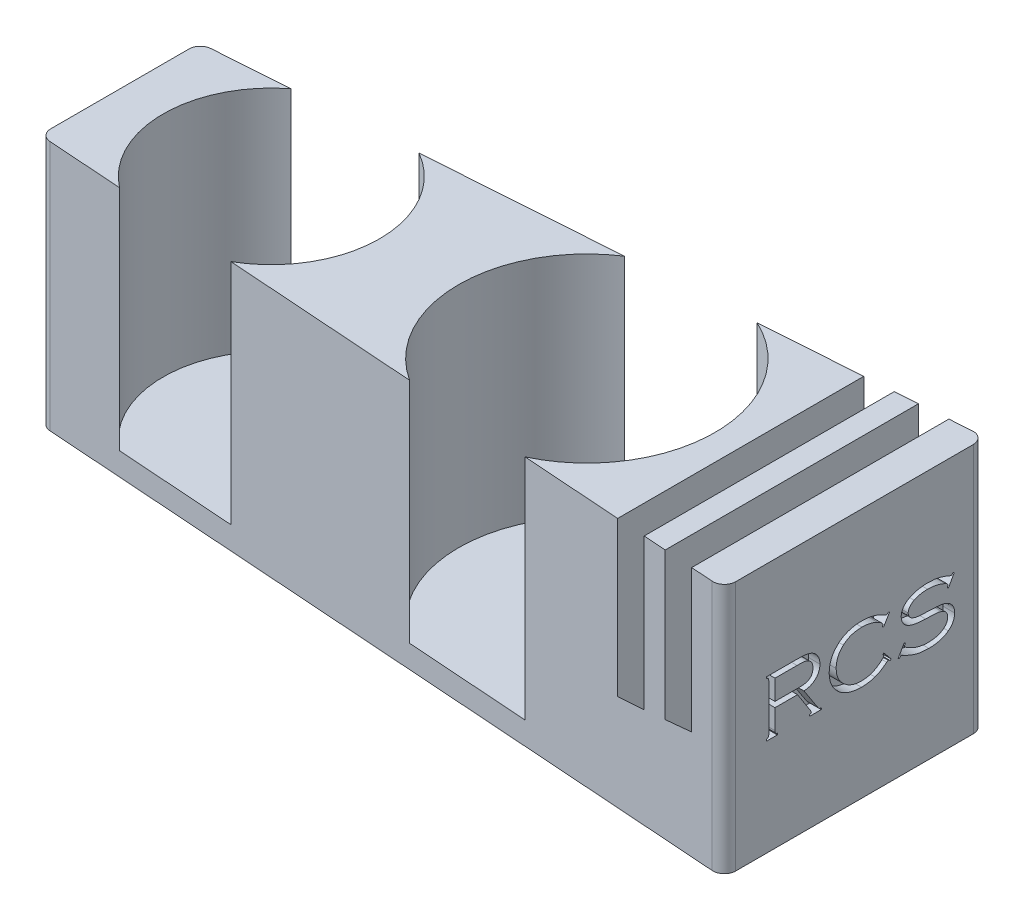
from build123d import *

# Parameters (mm, degrees)
BOSS_EXTRUDE1_DEPTH = 2
BOSS_EXTRUDE2_DEPTH = 20
BOSS_EXTRUDE3_DEPTH = 20
SKETCH5_R           = 12.25
CUT_EXTRUDE1_DEPTH  = 2.5
SKETCH6_W           = 22.580720552
SKETCH6_H           = 12.500036581
CUT_EXTRUDE3_DEPTH  = 2.5
BOSS_EXTRUDE4_DEPTH = 20
BOSS_EXTRUDE5_DEPTH = 20
SKETCH10_R          = 12.25
CUT_EXTRUDE4_DEPTH  = 2.5
CUT_EXTRUDE5_DEPTH  = 2.5
BOSS_EXTRUDE6_DEPTH = 20
SKETCH13_R          = 9.5
CUT_EXTRUDE6_DEPTH  = 20
SKETCH14_R          = 11.25
CUT_EXTRUDE7_DEPTH  = 20
CUT_EXTRUDE8_DEPTH  = 1
FILLET2_R           = 1


with BuildPart() as part:
    # Sketch1 → Boss-Extrude1 (new body)
    with BuildSketch(Plane(origin=(0, 0, 0), x_dir=(1, 0, 0), z_dir=(0, 1, 0))):
        Polygon((0, 7), (64.5, 11.5), (64.5, -11.5), (0, -7), align=None)
    extrude(amount=BOSS_EXTRUDE1_DEPTH)

    # Sketch2 → Boss-Extrude2 (add)
    with BuildSketch(Plane(origin=(0, 2, 0), x_dir=(1, 0, 0), z_dir=(0, 1, 0))):
        Polygon((61.502303199, 11.290858363), (61.497417875, -11.290517526), (64.5, -11.5), (64.5, 11.5), align=None)
    extrude(amount=BOSS_EXTRUDE2_DEPTH)

    # Sketch4 → Boss-Extrude3 (add)
    with BuildSketch(Plane(origin=(0, 2, 0), x_dir=(1, 0, 0), z_dir=(0, 1, 0))):
        Polygon((61.497417875, -11.290517526), (61.502303199, 11.290858363), (58.995164106, 11.115941682), (58.995163799, -11.11594166), align=None)
    extrude(amount=BOSS_EXTRUDE3_DEPTH)

    # Sketch5 → Cut-Extrude1 (cut)
    with BuildSketch(Plane(origin=(58.995163952, 0, 8.13e-07), x_dir=(-1.3778228676003005e-08, 0, 1.0), z_dir=(-1.0, 0, -1.3778228676003005e-08))):
        with Locations((0, 14.252883097)):
            Circle(SKETCH5_R)
    extrude(amount=-CUT_EXTRUDE1_DEPTH, mode=Mode.SUBTRACT)

    # Sketch6 → Cut-Extrude3 (cut)
    with BuildSketch(Plane(origin=(61.495163952, 0, 8.47e-07), x_dir=(-1.3778228676003005e-08, 0, 1.0), z_dir=(-1.0, 0, -1.3778228676003005e-08))):
        with Locations((-8.58e-07, 15.74998171)):
            Rectangle(SKETCH6_W, SKETCH6_H)
    extrude(amount=CUT_EXTRUDE3_DEPTH, mode=Mode.SUBTRACT)

    # Sketch8 → Boss-Extrude4 (add)
    with BuildSketch(Plane(origin=(0, 2, 0), x_dir=(1, 0, 0), z_dir=(0, 1, 0))):
        Polygon((58.995164106, 11.115941682), (57.006604835, 10.977204988), (57.006604835, -10.977204988), (58.995163799, -11.11594166), align=None)
    extrude(amount=BOSS_EXTRUDE4_DEPTH)

    # Sketch9 → Boss-Extrude5 (add)
    with BuildSketch(Plane(origin=(0, 2, 0), x_dir=(1, 0, 0), z_dir=(0, 1, 0))):
        Polygon((57.006604835, 10.977204988), (54.508882385, 10.802945283), (54.508862519, -10.802943897), (57.006604835, -10.977204988), align=None)
    extrude(amount=BOSS_EXTRUDE5_DEPTH)

    # Sketch10 → Cut-Extrude4 (cut)
    with BuildSketch(Plane(origin=(54.508872452, 0, 5.0119e-05), x_dir=(-9.194676961695594e-07, 0, 0.9999999999995773), z_dir=(-0.9999999999995773, 0, -9.194676961695594e-07))):
        with Locations((0, 14.224043544)):
            Circle(SKETCH10_R)
    extrude(amount=-CUT_EXTRUDE4_DEPTH, mode=Mode.SUBTRACT)

    # Sketch11 → Cut-Extrude5 (cut)
    with BuildSketch(Plane(origin=(57.008872452, 0, 5.2418e-05), x_dir=(-9.194676961695594e-07, 0, 0.9999999999995773), z_dir=(-0.9999999999995773, 0, -9.194676961695594e-07))):
        Polygon((-10.977416316, 8.787240161), (-10.977416316, 22), (11.07155829, 22), (10.977310072, 8.78702565), align=None)
    extrude(amount=CUT_EXTRUDE5_DEPTH, mode=Mode.SUBTRACT)

    # Sketch12 → Boss-Extrude6 (add)
    with BuildSketch(Plane(origin=(0, 2, 0), x_dir=(1, 0, 0), z_dir=(0, 1, 0))):
        Polygon((54.508903175, 10.802946733), (0, 7), (0, -7), (54.508862519, -10.802943897), align=None)
    extrude(amount=BOSS_EXTRUDE6_DEPTH)

    # Sketch13 → Cut-Extrude6 (cut)
    with BuildSketch(Plane(origin=(0, 22, 0), x_dir=(1, 0, 0), z_dir=(0, 1, 0))):
        with Locations((13.3, 0)):
            Circle(SKETCH13_R)
    extrude(amount=-CUT_EXTRUDE6_DEPTH, mode=Mode.SUBTRACT)

    # Sketch14 → Cut-Extrude7 (cut)
    with BuildSketch(Plane(origin=(0, 22, 0), x_dir=(1, 0, 0), z_dir=(0, 1, 0))):
        with Locations((41, 0)):
            Circle(SKETCH14_R)
    extrude(amount=-CUT_EXTRUDE7_DEPTH, mode=Mode.SUBTRACT)

    # Sketch15 → Cut-Extrude8 (cut)
    # profile 1 of 3: a face of its own
    with BuildSketch(Plane(origin=(64.5, 0, 0), x_dir=(0, 0, -1), z_dir=(1, 0, 0))):
        with BuildLine():
            Line((-6.982134582, 10.694974764), (-6.982134582, 8.956091526))
            add(Edge.make_bspline(
                [(-6.982134582, 8.956091526), (-6.98203032, 8.933742839), (-6.981837395, 8.892389471), (-6.972993331, 8.83579956), (-6.960908862, 8.7889922), (-6.942711467, 8.750557828), (-6.914793079, 8.719830406), (-6.877736044, 8.694801894), (-6.831529024, 8.672431884), (-6.79677405, 8.66138617), (-6.77818493, 8.655478236)],
                knots=[0, 0, 0, 0, 1.327292751, 2.455984248, 3.396056187, 4.196519374, 4.957218112, 5.833575765, 6.841261664, 8, 8, 8, 8], degree=3))
            Line((-6.77818493, 8.655478236), (-6.77818493, 8.519511801))
            Line((-6.77818493, 8.519511801), (-7.729949976, 8.519511801))
            Line((-7.729949976, 8.519511801), (-7.729949976, 8.655478236))
            add(Edge.make_bspline(
                [(-7.729949976, 8.655478236), (-7.711360728, 8.661386131), (-7.676605517, 8.672431772), (-7.630400033, 8.694802253), (-7.593338257, 8.719829311), (-7.565435121, 8.750561413), (-7.547028033, 8.789288679), (-7.535088965, 8.83723176), (-7.526318586, 8.895587306), (-7.526111812, 8.938347235), (-7.526000323, 8.961402715)],
                knots=[0, 0, 0, 0, 1.143860438, 2.138607913, 3.003713363, 3.754644928, 4.544830376, 5.492870617, 6.648195317, 8, 8, 8, 8], degree=3))
            Line((-7.526000323, 8.961402715), (-7.526000323, 12.972412553))
            add(Edge.make_bspline(
                [(-7.526000323, 12.972412553), (-7.526093765, 12.995474411), (-7.526267067, 13.038246169), (-7.535300143, 13.096865855), (-7.546748119, 13.145350982), (-7.565774472, 13.184383007), (-7.592933314, 13.216087063), (-7.630227262, 13.241216836), (-7.676717319, 13.262338831), (-7.711381598, 13.272756611), (-7.729949976, 13.278337032)],
                knots=[0, 0, 0, 0, 1.348407392, 2.500828586, 3.466505965, 4.254705557, 5.01937148, 5.882302788, 6.865627628, 8, 8, 8, 8], degree=3))
            Line((-7.729949976, 13.278337032), (-7.729949976, 13.414303468))
            Line((-7.729949976, 13.414303468), (-5.039301692, 13.414303468))
            add(Edge.make_bspline(
                [(-5.039301692, 13.414303468), (-4.952191108, 13.413349297), (-4.787106619, 13.411541034), (-4.553852214, 13.401946133), (-4.349291413, 13.383055004), (-4.170247374, 13.35705029), (-4.01103459, 13.320553967), (-3.865238811, 13.273566558), (-3.729821486, 13.216139057), (-3.646949903, 13.167342893), (-3.606342934, 13.143432835)],
                knots=[0, 0, 0, 0, 1.414819568, 2.681244393, 3.790189265, 4.749857557, 5.617503166, 6.439488343, 7.235351294, 8, 8, 8, 8], degree=3))
            add(Edge.make_bspline(
                [(-3.606342934, 13.143432835), (-3.566545443, 13.116535819), (-3.487247757, 13.062942714), (-3.382735812, 12.962642943), (-3.287969844, 12.850478576), (-3.236992562, 12.765698165), (-3.211190481, 12.722786676)],
                knots=[0, 0, 0, 0, 0.987068848, 1.966764049, 2.970880412, 4, 4, 4, 4], degree=3))
            add(Edge.make_bspline(
                [(-3.211190481, 12.722786676), (-3.184578822, 12.671020272), (-3.131359455, 12.567495151), (-3.077529992, 12.399195757), (-3.044925246, 12.221631884), (-3.04107169, 12.099751935), (-3.039107962, 12.037643311)],
                knots=[0, 0, 0, 0, 0.976717653, 1.953290301, 2.95702022, 4, 4, 4, 4], degree=3))
            add(Edge.make_bspline(
                [(-3.039107962, 12.037643311), (-3.039873216, 11.991185871), (-3.041374861, 11.900023281), (-3.060707553, 11.766862005), (-3.088393102, 11.639461278), (-3.130357304, 11.519397342), (-3.182928982, 11.405536143), (-3.246294485, 11.297568771), (-3.323932811, 11.197872863), (-3.410681298, 11.103929581), (-3.508620654, 11.019297949), (-3.615309053, 10.943493938), (-3.730641581, 10.87750265), (-3.854686911, 10.8208524), (-3.987786372, 10.77448636), (-4.129402614, 10.737073713), (-4.279826924, 10.710876718), (-4.383114627, 10.700356366), (-4.435950636, 10.694974764)],
                knots=[0, 0, 0, 0, 1.032453981, 2.025965659, 2.986981725, 3.928436394, 4.848129052, 5.773335344, 6.705853521, 7.653153547, 8.613330213, 9.579206836, 10.559963337, 11.56437173, 12.608029044, 13.691145095, 14.818923504, 16, 16, 16, 16], degree=3))
            Line((-4.435950636, 10.694974764), (-3.218626146, 8.830747469))
            add(Edge.make_bspline(
                [(-3.218626146, 8.830747469), (-3.199710454, 8.804108531), (-3.163161857, 8.752637199), (-3.0878916, 8.695306346), (-2.999452337, 8.660549876), (-2.936044593, 8.657210882), (-2.903141527, 8.655478236)],
                knots=[0, 0, 0, 0, 1.032470711, 1.994923467, 2.959540884, 4, 4, 4, 4], degree=3))
            Line((-2.903141527, 8.655478236), (-2.903141527, 8.519511801))
            Line((-2.903141527, 8.519511801), (-3.952632448, 8.519511801))
            Line((-3.952632448, 8.519511801), (-3.952632448, 8.655478236))
            add(Edge.make_bspline(
                [(-3.952632448, 8.655478236), (-3.928342073, 8.660510858), (-3.885649027, 8.669356253), (-3.832012923, 8.688730584), (-3.794996608, 8.716948615), (-3.789421526, 8.741985285), (-3.786923355, 8.753204111)],
                knots=[0, 0, 0, 0, 1.445170674, 2.540048811, 3.345801974, 4, 4, 4, 4], degree=3))
            add(Edge.make_bspline(
                [(-3.786923355, 8.753204111), (-3.78914121, 8.762501108), (-3.795340142, 8.788486328), (-3.819357611, 8.835031451), (-3.854919302, 8.901796285), (-3.88539492, 8.952002333), (-3.902707273, 8.980522995)],
                knots=[0, 0, 0, 0, 0.44689934, 1.249089129, 2.437283923, 4, 4, 4, 4], degree=3))
            Line((-3.902707273, 8.980522995), (-5.004247845, 10.694974764))
            Line((-5.004247845, 10.694974764), (-6.982134582, 10.694974764))
        make_face()
        with BuildLine():
            Line((-6.982134582, 11.170857287), (-4.996812181, 11.170857287))
            add(Edge.make_bspline(
                [(-4.996812181, 11.170857287), (-4.933426113, 11.171209552), (-4.814761162, 11.171869028), (-4.649308652, 11.178009062), (-4.508573901, 11.188119218), (-4.389650544, 11.202722139), (-4.285863773, 11.223357022), (-4.191254555, 11.250860702), (-4.102617177, 11.285668697), (-4.047635802, 11.314809642), (-4.020615666, 11.329130715)],
                knots=[0, 0, 0, 0, 1.520823022, 2.847130214, 3.971774452, 4.905411492, 5.72015636, 6.507876598, 7.266708457, 8, 8, 8, 8], degree=3))
            add(Edge.make_bspline(
                [(-4.020615666, 11.329130715), (-3.990883778, 11.347671378), (-3.932591301, 11.384022287), (-3.8580126, 11.453952588), (-3.793008473, 11.53067471), (-3.740992586, 11.617699978), (-3.700021149, 11.713417146), (-3.672110068, 11.818634622), (-3.653150229, 11.932506741), (-3.651702635, 12.011712497), (-3.65095692, 12.05251464)],
                knots=[0, 0, 0, 0, 0.982641165, 1.926570845, 2.859311877, 3.801456098, 4.764550391, 5.776195376, 6.854426767, 8, 8, 8, 8], degree=3))
            add(Edge.make_bspline(
                [(-3.65095692, 12.05251464), (-3.652325105, 12.093634302), (-3.654979301, 12.173403965), (-3.671234745, 12.288492596), (-3.701546224, 12.394002377), (-3.742878847, 12.490892274), (-3.797223437, 12.578107123), (-3.863369099, 12.656109346), (-3.941197262, 12.724907694), (-4.000889772, 12.761528918), (-4.031238044, 12.780147516)],
                knots=[0, 0, 0, 0, 1.141908399, 2.215233359, 3.217213402, 4.181493512, 5.130824203, 6.058529557, 7.012936919, 8, 8, 8, 8], degree=3))
            add(Edge.make_bspline(
                [(-4.031238044, 12.780147516), (-4.060074346, 12.794717627), (-4.118139205, 12.824056044), (-4.209680673, 12.860972645), (-4.307029258, 12.886438761), (-4.411923863, 12.907688955), (-4.533666506, 12.922741418), (-4.679822592, 12.930781011), (-4.854409932, 12.937603578), (-4.980161109, 12.938135068), (-5.047799594, 12.938420944)],
                knots=[0, 0, 0, 0, 0.745341083, 1.500820907, 2.271778287, 3.063238885, 3.96911947, 5.09888871, 6.439563143, 8, 8, 8, 8], degree=3))
            Line((-5.047799594, 12.938420944), (-6.982134582, 12.938420944))
            Line((-6.982134582, 12.938420944), (-6.982134582, 11.170857287))
        make_face(mode=Mode.SUBTRACT)
    # profile 2 of 3: a face of its own
    with BuildSketch(Plane(origin=(64.5, 0, 0), x_dir=(0, 0, -1), z_dir=(1, 0, 0))):
        with BuildLine():
            Line((3.079381621, 12.938420944), (2.549324972, 12.05251464))
            Line((2.549324972, 12.05251464), (2.452661334, 12.113062193))
            add(Edge.make_bspline(
                [(2.452661334, 12.113062193), (2.462179093, 12.146823562), (2.478671449, 12.205325204), (2.482787707, 12.265900796), (2.484528467, 12.29151814)],
                knots=[0, 0, 0, 0, 1.154202433, 2, 2, 2, 2], degree=3))
            add(Edge.make_bspline(
                [(2.484528467, 12.29151814), (2.482818147, 12.305192437), (2.479128294, 12.334693427), (2.455365997, 12.378271109), (2.417899138, 12.422596157), (2.367527603, 12.470659576), (2.302144288, 12.519899021), (2.222785081, 12.571962308), (2.129592625, 12.626987002), (2.061580049, 12.662561565), (2.025641749, 12.681359403)],
                knots=[0, 0, 0, 0, 0.528427833, 1.140032483, 1.879037193, 2.768916703, 3.822049475, 5.035818927, 6.433706882, 8, 8, 8, 8], degree=3))
            add(Edge.make_bspline(
                [(2.025641749, 12.681359403), (1.972863624, 12.707578409), (1.867425708, 12.759957637), (1.703541591, 12.825393708), (1.536129283, 12.880146858), (1.366417125, 12.927997904), (1.192243788, 12.96233598), (1.015025993, 12.988154802), (0.833714414, 13.003122129), (0.711680024, 13.005302777), (0.65004383, 13.006404162)],
                knots=[0, 0, 0, 0, 0.990833998, 1.979446473, 2.964339273, 3.952521199, 4.942889807, 5.947602928, 6.963391035, 8, 8, 8, 8], degree=3))
            add(Edge.make_bspline(
                [(0.65004383, 13.006404162), (0.568165663, 13.004993454), (0.408205408, 13.002237441), (0.174657661, 12.974270561), (-0.047386934, 12.932903594), (-0.257657796, 12.872174104), (-0.456089905, 12.793323635), (-0.642708881, 12.697150136), (-0.818465533, 12.58520431), (-0.924391536, 12.49631744), (-0.977304441, 12.451916044)],
                knots=[0, 0, 0, 0, 1.116881908, 2.181982346, 3.205473248, 4.196440491, 5.163727822, 6.11461875, 7.058201043, 8, 8, 8, 8], degree=3))
            add(Edge.make_bspline(
                [(-0.977304441, 12.451916044), (-1.028046738, 12.404165549), (-1.128134025, 12.30997948), (-1.256399707, 12.150910825), (-1.367212256, 11.983617274), (-1.45720985, 11.804671851), (-1.52584861, 11.614725546), (-1.575951043, 11.415156822), (-1.606543823, 11.20508892), (-1.6097969, 11.061551604), (-1.611460392, 10.98815239)],
                knots=[0, 0, 0, 0, 1.014640989, 2.001341491, 2.970512027, 3.935371108, 4.913448052, 5.908657242, 6.930571361, 8, 8, 8, 8], degree=3))
            add(Edge.make_bspline(
                [(-1.611460392, 10.98815239), (-1.609428616, 10.915097287), (-1.605435199, 10.771508945), (-1.573670839, 10.561157973), (-1.523165176, 10.360043096), (-1.450176565, 10.168393728), (-1.356416157, 9.986574464), (-1.242419385, 9.81399939), (-1.108880533, 9.650115199), (-1.004698757, 9.552631643), (-0.951810734, 9.50314398)],
                knots=[0, 0, 0, 0, 1.045243101, 2.054404389, 3.037758508, 4.008189886, 4.982846867, 5.959767557, 6.964273164, 8, 8, 8, 8], degree=3))
            add(Edge.make_bspline(
                [(-0.951810734, 9.50314398), (-0.897778438, 9.457082592), (-0.790722385, 9.365819573), (-0.616001987, 9.248827964), (-0.432605487, 9.149263959), (-0.239110327, 9.06870713), (-0.037082686, 9.004200384), (0.174819738, 8.960593878), (0.395354764, 8.931440664), (0.545847079, 8.928770056), (0.622425648, 8.927411106)],
                knots=[0, 0, 0, 0, 0.992433811, 1.966343341, 2.934746802, 3.906992647, 4.893800048, 5.896242675, 6.929495341, 8, 8, 8, 8], degree=3))
            add(Edge.make_bspline(
                [(0.622425648, 8.927411106), (0.697584829, 8.928810155), (0.846303085, 8.931578468), (1.065428974, 8.960685023), (1.278101894, 9.004754649), (1.483896357, 9.067876611), (1.683144736, 9.148586089), (1.875111058, 9.248354906), (2.061145178, 9.365000317), (2.177250448, 9.456042004), (2.235964828, 9.502081743)],
                knots=[0, 0, 0, 0, 1.031172007, 2.040390831, 3.028950235, 4.009892534, 4.991015447, 5.975791656, 6.976358799, 8, 8, 8, 8], degree=3))
            add(Edge.make_bspline(
                [(2.235964828, 9.502081743), (2.260982462, 9.520913292), (2.308283668, 9.556518377), (2.371508327, 9.611121613), (2.426212095, 9.659816709), (2.47111536, 9.703971392), (2.505667085, 9.74454985), (2.530444481, 9.780644398), (2.547183446, 9.812700453), (2.55013699, 9.833719776), (2.551449447, 9.843060068)],
                knots=[0, 0, 0, 0, 1.587426528, 3.001370576, 4.234572792, 5.301084547, 6.1931032, 6.9301606, 7.524598697, 8, 8, 8, 8], degree=3))
            add(Edge.make_bspline(
                [(2.551449447, 9.843060068), (2.550266884, 9.852664633), (2.547507241, 9.875077971), (2.536114179, 9.912637592), (2.516622035, 9.957842473), (2.499977832, 9.990111116), (2.490901894, 10.007706924)],
                knots=[0, 0, 0, 0, 0.656862919, 1.532863812, 2.654692323, 4, 4, 4, 4], degree=3))
            Line((2.490901894, 10.007706924), (2.576943154, 10.075690141))
            Line((2.576943154, 10.075690141), (3.215348057, 9.301318803))
            Line((3.215348057, 9.301318803), (3.126120084, 9.226962159))
            add(Edge.make_bspline(
                [(3.126120084, 9.226962159), (3.110528362, 9.240892316), (3.081940918, 9.266433278), (3.037826825, 9.295005923), (2.998642682, 9.315887794), (2.972284292, 9.318293279), (2.960410991, 9.319376845)],
                knots=[0, 0, 0, 0, 1.293860952, 2.372295961, 3.266790553, 4, 4, 4, 4], degree=3))
            add(Edge.make_bspline(
                [(2.960410991, 9.319376845), (2.952538322, 9.317886663), (2.933575852, 9.314297341), (2.902554707, 9.299305983), (2.86547995, 9.273696064), (2.838517988, 9.253289273), (2.823382318, 9.241833488)],
                knots=[0, 0, 0, 0, 0.602339461, 1.450822395, 2.56896506, 4, 4, 4, 4], degree=3))
            add(Edge.make_bspline(
                [(2.823382318, 9.241833488), (2.770823353, 9.201557917), (2.671150152, 9.125179033), (2.526728971, 9.020891424), (2.396319582, 8.932737807), (2.240918164, 8.834715467), (2.044671434, 8.733153815), (1.880819411, 8.671863048), (1.797260627, 8.640606907)],
                knots=[0, 0, 0, 0, 0.997120743, 1.890946972, 2.68215169, 3.367178705, 4.657353487, 6, 6, 6, 6], degree=3))
            add(Edge.make_bspline(
                [(1.797260627, 8.640606907), (1.70605278, 8.611102243), (1.521271781, 8.551327766), (1.230352432, 8.495640518), (0.927249277, 8.457464905), (0.720278877, 8.453530217), (0.614989984, 8.451528583)],
                knots=[0, 0, 0, 0, 0.955610556, 1.936003082, 2.950014347, 4, 4, 4, 4], degree=3))
            add(Edge.make_bspline(
                [(0.614989984, 8.451528583), (0.513643434, 8.453507712), (0.315386093, 8.457379346), (0.025339968, 8.489421013), (-0.249468248, 8.543894493), (-0.510578597, 8.617586033), (-0.756571693, 8.715210694), (-0.989360615, 8.831558359), (-1.20701055, 8.971302732), (-1.339161296, 9.080758115), (-1.405386264, 9.13560971)],
                knots=[0, 0, 0, 0, 1.114924198, 2.181050147, 3.205656836, 4.194615827, 5.161896158, 6.113211609, 7.054469962, 8, 8, 8, 8], degree=3))
            add(Edge.make_bspline(
                [(-1.405386264, 9.13560971), (-1.470459923, 9.195905408), (-1.598801049, 9.314823227), (-1.76564427, 9.513552706), (-1.907474502, 9.724191814), (-2.022547456, 9.947962028), (-2.113733323, 10.183469108), (-2.177006639, 10.432037488), (-2.216384935, 10.692649856), (-2.220971906, 10.870809305), (-2.223309351, 10.961596445)],
                knots=[0, 0, 0, 0, 1.029468752, 2.03036344, 3.005483654, 3.972873955, 4.946545143, 5.931937644, 6.94614926, 8, 8, 8, 8], degree=3))
            add(Edge.make_bspline(
                [(-2.223309351, 10.961596445), (-2.221536049, 11.033530972), (-2.218049851, 11.174949608), (-2.19466961, 11.383658823), (-2.153779514, 11.584502156), (-2.09910939, 11.778955644), (-2.026418503, 11.965494476), (-1.937203367, 12.144285764), (-1.835393377, 12.31787734), (-1.753537132, 12.424735026), (-1.712372981, 12.478471988)],
                knots=[0, 0, 0, 0, 1.057821681, 2.079609136, 3.08340757, 4.068984952, 5.046566163, 6.022259667, 7.005427102, 8, 8, 8, 8], degree=3))
            add(Edge.make_bspline(
                [(-1.712372981, 12.478471988), (-1.678542927, 12.519291284), (-1.611145813, 12.600612545), (-1.50113147, 12.714181085), (-1.385601238, 12.820350477), (-1.263772608, 12.918967898), (-1.135155844, 13.008635207), (-1.001272429, 13.092232357), (-0.860354242, 13.166307169), (-0.713799708, 13.23367393), (-0.560541003, 13.291565971), (-0.401462946, 13.342979287), (-0.236241848, 13.386422634), (-0.064506281, 13.421163227), (0.113002012, 13.449146762), (0.297069688, 13.467658591), (0.487360394, 13.479736372), (0.616387328, 13.481427753), (0.681910963, 13.482286685)],
                knots=[0, 0, 0, 0, 0.945323297, 1.883297627, 2.817501084, 3.742673649, 4.67655684, 5.612445219, 6.556058172, 7.514122137, 8.487631749, 9.476265062, 10.49494205, 11.532877102, 12.600271702, 13.698751591, 14.831359033, 16, 16, 16, 16], degree=3))
            add(Edge.make_bspline(
                [(0.681910963, 13.482286685), (0.769440876, 13.480372077), (0.944573743, 13.476541262), (1.205796604, 13.447897048), (1.465053971, 13.402608945), (1.7214737, 13.337100685), (1.97642382, 13.254131093), (2.22885293, 13.151765323), (2.479601221, 13.03189583), (2.641601839, 12.938776576), (2.723531967, 12.891682482)],
                knots=[0, 0, 0, 0, 0.976200939, 1.953216504, 2.927882183, 3.909755422, 4.902711129, 5.916307441, 6.946194151, 8, 8, 8, 8], degree=3))
            add(Edge.make_bspline(
                [(2.723531967, 12.891682482), (2.741536795, 12.881739169), (2.770215569, 12.865901082), (2.801994416, 12.858369555), (2.813822178, 12.855566398)],
                knots=[0, 0, 0, 0, 1.255620471, 2, 2, 2, 2], degree=3))
            add(Edge.make_bspline(
                [(2.813822178, 12.855566398), (2.823260125, 12.857895583), (2.847904436, 12.863977536), (2.884655343, 12.894226173), (2.931803861, 12.937857783), (2.964307302, 12.974836311), (2.982717984, 12.995781784)],
                knots=[0, 0, 0, 0, 0.518788388, 1.354657101, 2.501618075, 4, 4, 4, 4], degree=3))
            Line((2.982717984, 12.995781784), (3.079381621, 12.938420944))
        make_face()
    # profile 3 of 3: a face of its own
    with BuildSketch(Plane(origin=(64.5, 0, 0), x_dir=(0, 0, -1), z_dir=(1, 0, 0))):
        with BuildLine():
            Line((8.75598029, 13.104130037), (8.242919445, 12.182107649))
            Line((8.242919445, 12.182107649), (8.143069094, 12.235219537))
            add(Edge.make_bspline(
                [(8.143069094, 12.235219537), (8.152000707, 12.259623002), (8.167859704, 12.302953862), (8.1877451, 12.360343563), (8.199086162, 12.403044962), (8.202346668, 12.426749479), (8.203616647, 12.435982477)],
                knots=[0, 0, 0, 0, 1.483757732, 2.634564283, 3.46815771, 4, 4, 4, 4], degree=3))
            add(Edge.make_bspline(
                [(8.203616647, 12.435982477), (8.20276099, 12.445340289), (8.200973896, 12.464884678), (8.186367066, 12.492994361), (8.166233472, 12.522078608), (8.136287334, 12.550967599), (8.09829155, 12.58009639), (8.052047274, 12.609533819), (7.998730438, 12.64110442), (7.959130031, 12.659751822), (7.938057204, 12.669674787)],
                knots=[0, 0, 0, 0, 0.607169636, 1.268112509, 2.03013931, 2.91146364, 3.96412496, 5.148481403, 6.482602449, 8, 8, 8, 8], degree=3))
            add(Edge.make_bspline(
                [(7.938057204, 12.669674787), (7.877753777, 12.696448931), (7.757637888, 12.749779235), (7.573592317, 12.819373283), (7.38621591, 12.875875899), (7.19660337, 12.924975255), (7.003640857, 12.959898395), (6.808451924, 12.987066801), (6.610538559, 13.00335996), (6.477509681, 13.005385004), (6.410559283, 13.006404162)],
                knots=[0, 0, 0, 0, 1.004211035, 2.000246224, 2.992453697, 3.98197883, 4.979849601, 5.975301357, 6.9810154, 8, 8, 8, 8], degree=3))
            add(Edge.make_bspline(
                [(6.410559283, 13.006404162), (6.354956921, 13.005414831), (6.245777373, 13.003472204), (6.084720207, 12.993308006), (5.929504218, 12.973779078), (5.77928207, 12.947863115), (5.634910366, 12.91207915), (5.495137457, 12.871242319), (5.361253544, 12.821600842), (5.275841804, 12.78178242), (5.233599829, 12.762089474)],
                knots=[0, 0, 0, 0, 1.100774022, 2.161455134, 3.192520597, 4.19620711, 5.177095061, 6.135103414, 7.077680479, 8, 8, 8, 8], degree=3))
            add(Edge.make_bspline(
                [(5.233599829, 12.762089474), (5.194768097, 12.741444526), (5.119177917, 12.701256895), (5.017594338, 12.62598532), (4.926051437, 12.545043843), (4.850294823, 12.453388752), (4.787965171, 12.357587851), (4.743897675, 12.257151243), (4.715637833, 12.154265777), (4.712527243, 12.08420366), (4.710978844, 12.049327927)],
                knots=[0, 0, 0, 0, 1.13355636, 2.206590414, 3.254740046, 4.27976559, 5.265963583, 6.194811322, 7.101407709, 8, 8, 8, 8], degree=3))
            add(Edge.make_bspline(
                [(4.710978844, 12.049327927), (4.712122584, 12.020176813), (4.714410149, 11.96187243), (4.735674417, 11.875792985), (4.770071393, 11.792641753), (4.816625906, 11.713029411), (4.874859121, 11.64068635), (4.941370465, 11.575756007), (5.01706097, 11.520785157), (5.073439496, 11.49365539), (5.101882345, 11.47996848)],
                knots=[0, 0, 0, 0, 0.957919062, 1.915908973, 2.898175121, 3.911258258, 4.939304541, 5.944518821, 6.963014016, 8, 8, 8, 8], degree=3))
            add(Edge.make_bspline(
                [(5.101882345, 11.47996848), (5.135298741, 11.465908726), (5.204252309, 11.436896917), (5.314788859, 11.404115442), (5.433426938, 11.37570413), (5.539634143, 11.359879488), (5.633233943, 11.348538376), (5.714723827, 11.341313202), (5.806481577, 11.335223733), (5.908454511, 11.328786735), (6.021059446, 11.322526799), (6.143899968, 11.315933251), (6.277046664, 11.310681279), (6.369129011, 11.308141977), (6.41693271, 11.306823722)],
                knots=[0, 0, 0, 0, 0.977326068, 2.016678256, 3.105629518, 4.266128525, 4.9106475, 5.649171883, 6.472626623, 7.391392157, 8.405507546, 9.51500178, 10.709936153, 12, 12, 12, 12], degree=3))
            add(Edge.make_bspline(
                [(6.41693271, 11.306823722), (6.483154633, 11.304939104), (6.610674613, 11.301309996), (6.794750386, 11.2922125), (6.964345803, 11.283652818), (7.119193769, 11.276106831), (7.258963086, 11.264681426), (7.384386557, 11.2545656), (7.495281184, 11.243151137), (7.621285795, 11.226415359), (7.762066459, 11.201627674), (7.91659088, 11.16129339), (8.056075286, 11.112649728), (8.13994124, 11.069457993), (8.180247416, 11.048699943)],
                knots=[0, 0, 0, 0, 1.327296927, 2.555903972, 3.692392932, 4.729698951, 5.661742112, 6.501857616, 7.250824416, 7.89495221, 9.048516985, 10.111912734, 11.092580788, 12, 12, 12, 12], degree=3))
            add(Edge.make_bspline(
                [(8.180247416, 11.048699943), (8.228930084, 11.019902102), (8.323561679, 10.96392354), (8.447980554, 10.8599853), (8.553618072, 10.746104781), (8.642012912, 10.621548222), (8.707110754, 10.484056319), (8.755759262, 10.336869252), (8.784868308, 10.178097157), (8.788238736, 10.068376927), (8.789971899, 10.011955875)],
                knots=[0, 0, 0, 0, 1.069345705, 2.078643101, 3.055776152, 4.004137249, 4.9574836, 5.924075733, 6.932504666, 8, 8, 8, 8], degree=3))
            add(Edge.make_bspline(
                [(8.789971899, 10.011955875), (8.788531086, 9.957658148), (8.785706539, 9.851213786), (8.75772971, 9.695521714), (8.714724389, 9.547337508), (8.65318516, 9.406446926), (8.574500534, 9.272967986), (8.476367481, 9.148378767), (8.362421271, 9.030383071), (8.275606582, 8.960833851), (8.23123483, 8.925286631)],
                knots=[0, 0, 0, 0, 1.025233928, 2.009851588, 2.979622151, 3.935627171, 4.907680718, 5.899548307, 6.926440625, 8, 8, 8, 8], degree=3))
            add(Edge.make_bspline(
                [(8.23123483, 8.925286631), (8.177886614, 8.886800871), (8.069998911, 8.80896996), (7.890406488, 8.714945306), (7.698830512, 8.631857767), (7.491278052, 8.567034134), (7.269847096, 8.514685821), (7.033307802, 8.478190045), (6.782433929, 8.45551916), (6.610310292, 8.452880789), (6.52209425, 8.451528583)],
                knots=[0, 0, 0, 0, 0.873662435, 1.766833848, 2.688584958, 3.647476082, 4.653577257, 5.711695763, 6.827208478, 8, 8, 8, 8], degree=3))
            add(Edge.make_bspline(
                [(6.52209425, 8.451528583), (6.420772677, 8.452720128), (6.224568543, 8.455027494), (5.940557957, 8.479401825), (5.675968209, 8.515320734), (5.466855531, 8.560292463), (5.304469966, 8.606584046), (5.179073933, 8.647034626), (5.048126632, 8.694122662), (4.911375746, 8.747160201), (4.768487505, 8.806699337), (4.620607751, 8.874057381), (4.465924874, 8.945693783), (4.36240511, 8.998252362), (4.309452965, 9.025136982)],
                knots=[0, 0, 0, 0, 1.577079198, 3.053934603, 4.434610073, 5.73212484, 6.37954586, 7.062931899, 7.783061352, 8.545736752, 9.346338084, 10.192645224, 11.075506861, 12, 12, 12, 12], degree=3))
            add(Edge.make_bspline(
                [(4.309452965, 9.025136982), (4.282265735, 9.037377601), (4.23450551, 9.058880886), (4.171831527, 9.084267346), (4.128139764, 9.100950645), (4.104489645, 9.10534228), (4.095943172, 9.10692929)],
                knots=[0, 0, 0, 0, 1.560868491, 2.742001726, 3.545395613, 4, 4, 4, 4], degree=3))
            add(Edge.make_bspline(
                [(4.095943172, 9.10692929), (4.08508552, 9.104688179), (4.059473948, 9.099401734), (4.020576408, 9.072206682), (3.974360211, 9.031844791), (3.942639672, 8.997551984), (3.92492289, 8.97839852)],
                knots=[0, 0, 0, 0, 0.606031744, 1.429537914, 2.564327146, 4, 4, 4, 4], degree=3))
            Line((3.92492289, 8.97839852), (3.827197015, 9.038946073))
            Line((3.827197015, 9.038946073), (4.365751567, 9.938661468))
            Line((4.365751567, 9.938661468), (4.466664155, 9.881300628))
            add(Edge.make_bspline(
                [(4.466664155, 9.881300628), (4.456489722, 9.859450657), (4.438122221, 9.820005769), (4.416918129, 9.765799136), (4.402472826, 9.723374785), (4.399787562, 9.698304903), (4.398680938, 9.687973353)],
                knots=[0, 0, 0, 0, 1.403778314, 2.534185348, 3.39592305, 4, 4, 4, 4], degree=3))
            add(Edge.make_bspline(
                [(4.398680938, 9.687973353), (4.400495789, 9.677447748), (4.404606264, 9.653608188), (4.429583615, 9.618944329), (4.465149671, 9.580162496), (4.517145941, 9.538992979), (4.581433126, 9.492115773), (4.661709741, 9.443061756), (4.755128806, 9.388742788), (4.822746895, 9.352447053), (4.858629894, 9.333185936)],
                knots=[0, 0, 0, 0, 0.42669469, 0.966425524, 1.685134264, 2.558661903, 3.634421735, 4.900364347, 6.355111387, 8, 8, 8, 8], degree=3))
            add(Edge.make_bspline(
                [(4.858629894, 9.333185936), (4.926653653, 9.299245467), (5.059834038, 9.232795085), (5.260544672, 9.146376506), (5.457850761, 9.075929495), (5.653242271, 9.01966096), (5.851411596, 8.978110266), (6.055356107, 8.948251684), (6.267937361, 8.931465816), (6.412301272, 8.92878121), (6.485978165, 8.927411106)],
                knots=[0, 0, 0, 0, 1.076161654, 2.10696419, 3.091620022, 4.040495012, 4.983378908, 5.956055965, 6.956862242, 8, 8, 8, 8], degree=3))
            add(Edge.make_bspline(
                [(6.485978165, 8.927411106), (6.559686976, 8.928400097), (6.702443627, 8.930315541), (6.909549085, 8.951733754), (7.10342873, 8.982160454), (7.283492269, 9.028218254), (7.450518542, 9.085918759), (7.60255815, 9.159037797), (7.743080822, 9.241961635), (7.82520891, 9.310107194), (7.865825035, 9.343808314)],
                knots=[0, 0, 0, 0, 1.200581144, 2.32524367, 3.389485329, 4.395619224, 5.349982135, 6.263570837, 7.141255747, 8, 8, 8, 8], degree=3))
            add(Edge.make_bspline(
                [(7.865825035, 9.343808314), (7.890703037, 9.367086978), (7.939429157, 9.41268063), (8.003490058, 9.487211146), (8.05705908, 9.565874336), (8.101898997, 9.647072795), (8.136051053, 9.732051824), (8.161116384, 9.819882407), (8.17449764, 9.911342427), (8.17690916, 9.973323513), (8.178122941, 10.00452021)],
                knots=[0, 0, 0, 0, 1.083558152, 2.1222598, 3.119120567, 4.107285013, 5.06756785, 6.027057283, 7.006966457, 8, 8, 8, 8], degree=3))
            add(Edge.make_bspline(
                [(8.178122941, 10.00452021), (8.176461827, 10.044993214), (8.173238306, 10.123534214), (8.149129537, 10.236794), (8.105246659, 10.339342602), (8.046684536, 10.432780754), (7.970499342, 10.51627011), (7.877044617, 10.588252854), (7.766947486, 10.650499002), (7.686049135, 10.682511869), (7.64381734, 10.699223715)],
                knots=[0, 0, 0, 0, 1.029839954, 1.998484261, 2.92737069, 3.854901048, 4.79266239, 5.787731937, 6.845117989, 8, 8, 8, 8], degree=3))
            add(Edge.make_bspline(
                [(7.64381734, 10.699223715), (7.58582364, 10.718215121), (7.469500516, 10.756307873), (7.329288885, 10.777402462), (7.223185189, 10.78468904), (7.14531772, 10.790268743), (7.046123126, 10.795023317), (6.925781016, 10.801938256), (6.784099824, 10.80764674), (6.620911207, 10.815671929), (6.436750709, 10.822549547), (6.30681152, 10.828049031), (6.238476764, 10.830941199)],
                knots=[0, 0, 0, 0, 1.290798322, 2.589069018, 2.987663341, 3.543878352, 4.242322354, 5.09093925, 6.096854991, 7.245451188, 8.551388372, 10, 10, 10, 10], degree=3))
            add(Edge.make_bspline(
                [(6.238476764, 10.830941199), (6.188541105, 10.83285517), (6.091460548, 10.836576146), (5.949856993, 10.845496064), (5.816695115, 10.854783644), (5.691701636, 10.86551406), (5.575175281, 10.877019943), (5.466819642, 10.889821395), (5.36680849, 10.903155145), (5.246072685, 10.924435388), (5.104460171, 10.955637555), (4.944148272, 11.004766462), (4.792660142, 11.062626266), (4.698200578, 11.110880915), (4.651493528, 11.134741203)],
                knots=[0, 0, 0, 0, 1.103426511, 2.145185674, 3.132844786, 4.050961383, 4.915301806, 5.718303595, 6.460251326, 7.142805982, 8.425063637, 9.659245979, 10.84257654, 12, 12, 12, 12], degree=3))
            add(Edge.make_bspline(
                [(4.651493528, 11.134741203), (4.610357648, 11.158740101), (4.528985168, 11.206213254), (4.42062299, 11.297406153), (4.325865813, 11.401914438), (4.244892337, 11.518956489), (4.180534753, 11.645927687), (4.133142328, 11.779673503), (4.104763062, 11.919252781), (4.101020303, 12.014145656), (4.099129885, 12.06207478)],
                knots=[0, 0, 0, 0, 1.00717862, 1.992339131, 2.985119907, 3.987793364, 4.997314523, 5.991114465, 6.985338751, 8, 8, 8, 8], degree=3))
            add(Edge.make_bspline(
                [(4.099129885, 12.06207478), (4.100311081, 12.102876715), (4.102655838, 12.18387144), (4.122696584, 12.302692023), (4.152886135, 12.417851182), (4.198538916, 12.527416917), (4.254855673, 12.63349992), (4.324424327, 12.734267837), (4.405891378, 12.831448134), (4.468493748, 12.890186184), (4.500655764, 12.920362902)],
                knots=[0, 0, 0, 0, 1.000983626, 1.987023238, 2.950663146, 3.917551529, 4.893656174, 5.894224556, 6.918156239, 8, 8, 8, 8], degree=3))
            add(Edge.make_bspline(
                [(4.500655764, 12.920362902), (4.526217593, 12.941964734), (4.578351876, 12.98602246), (4.663498924, 13.046557493), (4.756639805, 13.102078909), (4.854841278, 13.157357881), (4.962263797, 13.205196169), (5.075189206, 13.252413266), (5.195974105, 13.294605672), (5.366850164, 13.347296423), (5.59155851, 13.402509459), (5.872808469, 13.448814753), (6.166385731, 13.476744475), (6.366237804, 13.480417762), (6.467920123, 13.482286685)],
                knots=[0, 0, 0, 0, 0.577531334, 1.177896235, 1.80052757, 2.448789327, 3.12153943, 3.828643486, 4.561278066, 5.328774236, 6.914895883, 8.550686374, 10.245030914, 12, 12, 12, 12], degree=3))
            add(Edge.make_bspline(
                [(6.467920123, 13.482286685), (6.548322132, 13.480904921), (6.706472186, 13.478187003), (6.939540092, 13.461445047), (7.163680255, 13.431757086), (7.382822261, 13.389341166), (7.604687735, 13.333244886), (7.835614869, 13.25875395), (8.080991295, 13.169979595), (8.246442607, 13.099310036), (8.332147418, 13.062702764)],
                knots=[0, 0, 0, 0, 1.001779309, 1.970491218, 2.909495588, 3.817092542, 4.750108648, 5.758857613, 6.839074275, 8, 8, 8, 8], degree=3))
            add(Edge.make_bspline(
                [(8.332147418, 13.062702764), (8.350132057, 13.055400906), (8.38202973, 13.042450282), (8.424805204, 13.02818072), (8.455567239, 13.016958628), (8.473027269, 13.014711348), (8.479798469, 13.013839826)],
                knots=[0, 0, 0, 0, 1.493082902, 2.648141695, 3.475733888, 4, 4, 4, 4], degree=3))
            add(Edge.make_bspline(
                [(8.479798469, 13.013839826), (8.491778729, 13.015922925), (8.520103295, 13.020847933), (8.560975091, 13.051447718), (8.607768255, 13.095143703), (8.638175709, 13.132333337), (8.655067702, 13.152992975)],
                knots=[0, 0, 0, 0, 0.630011535, 1.489517125, 2.605372993, 4, 4, 4, 4], degree=3))
            Line((8.655067702, 13.152992975), (8.75598029, 13.104130037))
        make_face()
    extrude(amount=-CUT_EXTRUDE8_DEPTH, mode=Mode.SUBTRACT)

    # Fillet2
    fillet2_edges = [part.edges().sort_by_distance(p)[0] for p in [
        (0, 11, -7),
        (64.5, 11, -11.5),
        (64.5, 11, 11.5),
        (0, 11, 7),
    ]]
    fillet(fillet2_edges, radius=FILLET2_R)


solid = part.part
